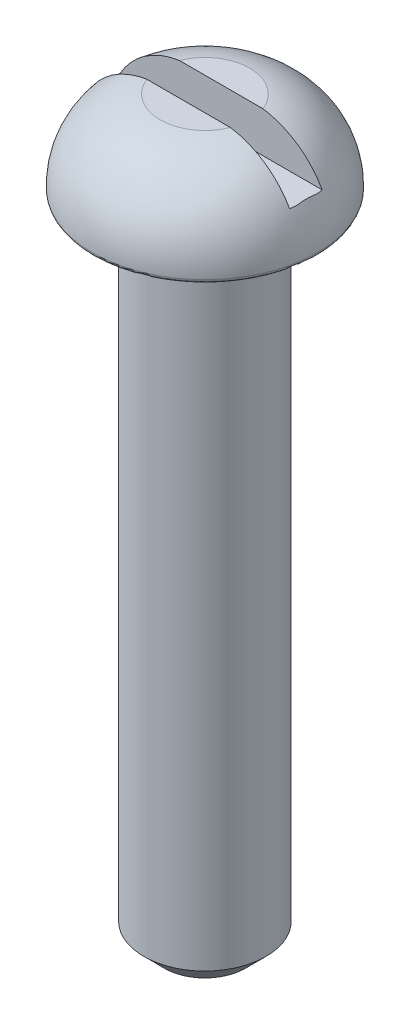
from build123d import *

# Parameters (mm, degrees)
FILLET_1_R          = 0.1
SKETCH_3_W          = 5
SKETCH_3_H          = 0.8
CUT_EXTRUDE_2_DEPTH = 1


with BuildPart() as part:
    # Эскиз1 → Повернуть1 (revolve)
    with BuildSketch(Plane.XY):
        with BuildLine():
            Line((2.75, 16), (1.5, 16))
            Line((1.5, 16), (1.5, 0.5))
            Line((1.5, 0.5), (1, 0))
            Line((1, 0), (0, 0))
            Line((0, 0), (0, 18.1))
            Line((0, 18.1), (1.1, 18.1))
            ThreePointArc((1.1, 18.1), (2.333466256, 17.370937772), (2.75, 16))
        make_face()
    revolve(axis=Axis((0, 0, 0), (0, 1, 0)))

    # Скругление1
    fillet_1_edges = [part.edges().sort_by_distance(p)[0] for p in [
        (-2.75, 16, 0),
    ]]
    fillet(fillet_1_edges, radius=FILLET_1_R)

    # Эскиз3 → Вырез-Вытянуть2 (cut)
    with BuildSketch(Plane(origin=(0, 18.1, 0), x_dir=(-1, 0, 0), z_dir=(0, 1, 0))):
        Rectangle(SKETCH_3_W, SKETCH_3_H)
    extrude(amount=-CUT_EXTRUDE_2_DEPTH, mode=Mode.SUBTRACT)


solid = part.part
